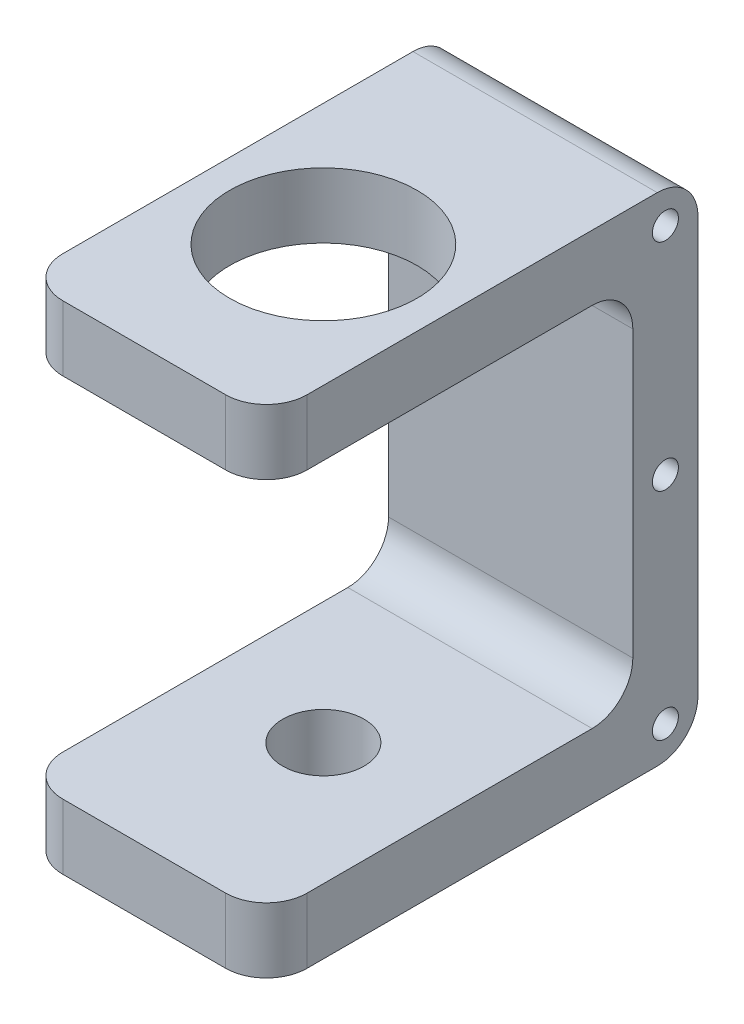
from build123d import *

# Parameters (mm, degrees)
BOSS_EXTRUDE1_DEPTH = 30
CUT_EXTRUDE1_REACH  = 88.197
SKETCH2_R           = 11.5
CUT_EXTRUDE2_REACH  = 82.734
SKETCH3_R           = 5
CUT_EXTRUDE3_REACH  = 82.734
SKETCH4_R           = 1.6
FILLET1_R           = 5
FILLET2_R           = 5


with BuildPart() as part:
    # Sketch1 → Boss-Extrude1 (new body)
    with BuildSketch(Plane(origin=(0, 0, 0), x_dir=(0, 0, -1), z_dir=(1, 0, 0))):
        Polygon((0, 0), (45, 0), (45, -45), (0, -45), (0, -53), (53, -53), (53, 8), (0, 8), align=None)
    extrude(amount=BOSS_EXTRUDE1_DEPTH)

    # Sketch2 → Cut-Extrude1 (cut, up to next)
    with BuildSketch(Plane(origin=(0, 8, 0), x_dir=(1, 0, 0), z_dir=(0, 1, 0)), mode=Mode.PRIVATE) as cut_extrude1_sk1:
        with Locations(Location((15, 22, 0), (0, 0, 270))):
            Circle(SKETCH2_R)
    cut_extrude1_tool1 = extrude(cut_extrude1_sk1.sketch, amount=-CUT_EXTRUDE1_REACH, mode=Mode.PRIVATE) & part.part
    add(cut_extrude1_tool1.solids().sort_by_distance((15, 8, -22))[0], mode=Mode.SUBTRACT)

    # Sketch3 → Cut-Extrude2 (cut, up to next)
    with BuildSketch(Plane(origin=(0, -45, 0), x_dir=(1, 0, 0), z_dir=(0, 1, 0)), mode=Mode.PRIVATE) as cut_extrude2_sk1:
        with Locations(Location((15, 22, 0), (0, 0, 270))):
            Circle(SKETCH3_R)
    cut_extrude2_tool1 = extrude(cut_extrude2_sk1.sketch, amount=-CUT_EXTRUDE2_REACH, mode=Mode.PRIVATE) & part.part
    add(cut_extrude2_tool1.solids().sort_by_distance((15, -45, -22))[0], mode=Mode.SUBTRACT)

    # Sketch4 → Cut-Extrude3 (cut, up to next)
    with BuildSketch(Plane(origin=(30, 0, 0), x_dir=(0, 0, -1), z_dir=(1, 0, 0)), mode=Mode.PRIVATE) as cut_extrude3_sk1:
        with Locations((49, -22.5)):
            Circle(SKETCH4_R)
    cut_extrude3_tool1 = extrude(cut_extrude3_sk1.sketch, amount=-CUT_EXTRUDE3_REACH, mode=Mode.PRIVATE) & part.part
    # Sketch4 → Cut-Extrude3 (cut, up to next)
    with BuildSketch(Plane(origin=(30, 0, 0), x_dir=(0, 0, -1), z_dir=(1, 0, 0)), mode=Mode.PRIVATE) as cut_extrude3_sk2:
        with Locations((49, -49)):
            Circle(SKETCH4_R)
    cut_extrude3_tool2 = extrude(cut_extrude3_sk2.sketch, amount=-CUT_EXTRUDE3_REACH, mode=Mode.PRIVATE) & part.part
    # Sketch4 → Cut-Extrude3 (cut, up to next)
    with BuildSketch(Plane(origin=(30, 0, 0), x_dir=(0, 0, -1), z_dir=(1, 0, 0)), mode=Mode.PRIVATE) as cut_extrude3_sk3:
        with Locations((49, 4)):
            Circle(SKETCH4_R)
    cut_extrude3_tool3 = extrude(cut_extrude3_sk3.sketch, amount=-CUT_EXTRUDE3_REACH, mode=Mode.PRIVATE) & part.part
    add(cut_extrude3_tool1.solids().sort_by_distance((30, -22.5, -49))[0], mode=Mode.SUBTRACT)
    add(cut_extrude3_tool2.solids().sort_by_distance((30, -49, -49))[0], mode=Mode.SUBTRACT)
    add(cut_extrude3_tool3.solids().sort_by_distance((30, 4, -49))[0], mode=Mode.SUBTRACT)

    # Fillet1
    fillet1_edges = [part.edges().sort_by_distance(p)[0] for p in [
        (0, 4, 0),
        (15, 8, -53),
        (15, -53, -53),
        (30, -49, 0),
        (30, 4, 0),
        (0, -49, 0),
    ]]
    fillet(fillet1_edges, radius=FILLET1_R)

    # Fillet2
    fillet2_edges = [part.edges().sort_by_distance(p)[0] for p in [
        (15, -45, -45),
        (15, 0, -45),
    ]]
    fillet(fillet2_edges, radius=FILLET2_R)


solid = part.part
